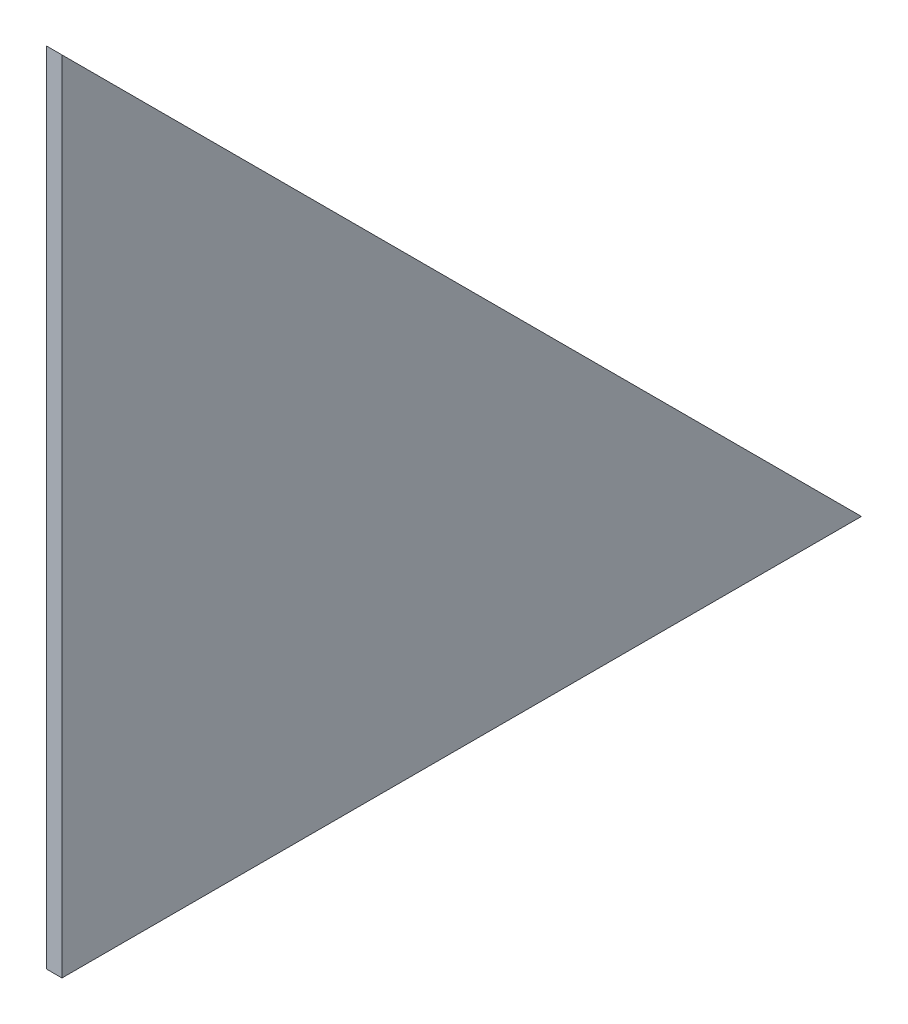
from build123d import *

# Parameters (mm, degrees)
BOSS_EXTRUDE1_DEPTH = 3.175


with BuildPart() as part:
    # Sketch1 → Boss-Extrude1 (new body)
    with BuildSketch(Plane(origin=(0, 0, 0), x_dir=(0, 0, -1), z_dir=(1, 0, 0))):
        Polygon((0, 0), (0, 165.1), (165.1, 0), align=None)
    extrude(amount=BOSS_EXTRUDE1_DEPTH)


solid = part.part
